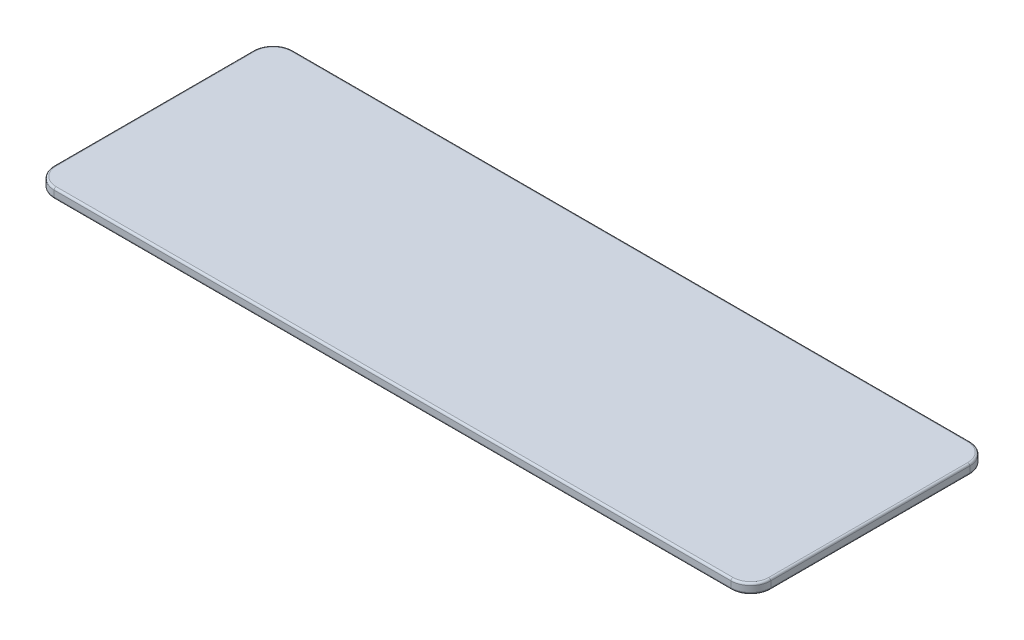
from build123d import *

# Parameters (mm, degrees)
SKETCH1_W           = 457.2
SKETCH1_H           = 152.4
BOSS_EXTRUDE1_DEPTH = 6.35
FILLET2_R           = 12.7
FILLET3_R           = 1.27


with BuildPart() as part:
    # Sketch1 → Boss-Extrude1 (new body)
    with BuildSketch(Plane(origin=(0, 0, 0), x_dir=(1, 0, 0), z_dir=(0, 1, 0))):
        Rectangle(SKETCH1_W, SKETCH1_H)
    extrude(amount=BOSS_EXTRUDE1_DEPTH)

    # Fillet2
    fillet2_edges = [part.edges().sort_by_distance(p)[0] for p in [
        (-228.6, 3.175, -76.2),
        (228.6, 3.175, -76.2),
        (228.6, 3.175, 76.2),
        (-228.6, 3.175, 76.2),
    ]]
    fillet(fillet2_edges, radius=FILLET2_R)

    # Fillet3
    fillet3_edges = [part.edges().sort_by_distance(p)[0] for p in [
        (228.6, 0, 0),
        (228.6, 6.35, 0),
        (-228.6, 0, 0),
        (0, 0, -76.2),
        (0, 0, 76.2),
        (-224.880256121, 0, 72.480256121),
        (-224.880256121, 0, -72.480256121),
        (224.880256121, 0, -72.480256121),
        (224.880256121, 0, 72.480256121),
        (0, 6.35, 76.2),
        (-228.6, 6.35, 0),
        (0, 6.35, -76.2),
        (-224.880256121, 6.35, 72.480256121),
        (-224.880256121, 6.35, -72.480256121),
        (224.880256121, 6.35, -72.480256121),
        (224.880256121, 6.35, 72.480256121),
    ]]
    fillet(fillet3_edges, radius=FILLET3_R)


solid = part.part
